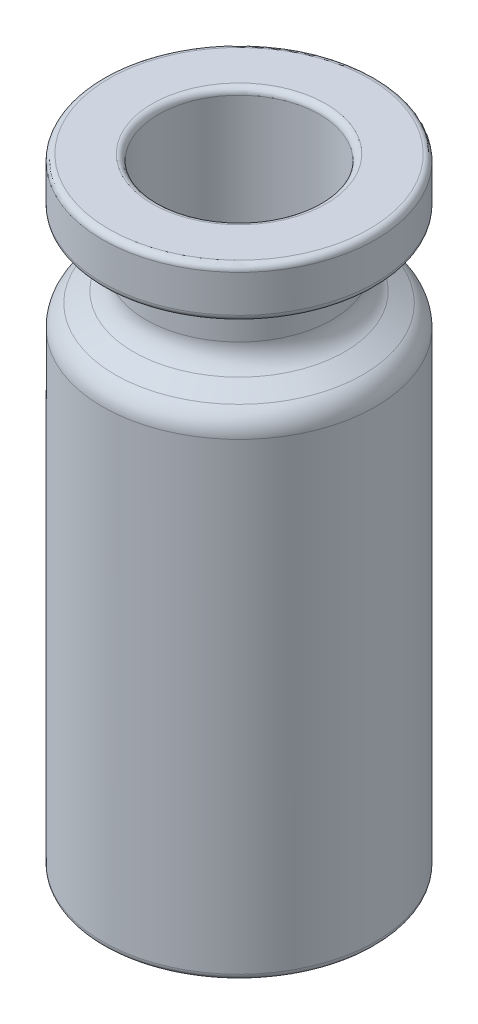
from build123d import *

# Parameters (mm, degrees)
FILLET1_R = 2
FILLET2_R = 0.5


with BuildPart() as part:
    # Sketch1 → Revolve1 (revolve)
    with BuildSketch(Plane.XY, mode=Mode.PRIVATE) as revolve1_sk:
        Polygon((0, 0), (11, 0), (11, 39), (7.5, 41), (7.5, 46), (11, 46), (11, 50), (6.5, 50), (6.5, 40.419677465), (10, 38.419677465), (10, 1), (0, 1), align=None)
    revolve(revolve1_sk.sketch.rotate(Axis((0, 0, 0), (0, 1, 0)), 90), axis=Axis((0, 0, 0), (0, 1, 0)))

    # Fillet1
    fillet1_edges = [part.edges().sort_by_distance(p)[0] for p in [
        (0, 46, 7.5),
        (0, 41, 7.5),
        (0, 39, 11),
    ]]
    fillet(fillet1_edges, radius=FILLET1_R)

    # Fillet2
    fillet2_edges = [part.edges().sort_by_distance(p)[0] for p in [
        (0, 50, 6.5),
        (0, 50, 11),
        (0, 46, 11),
        (0, 0, 11),
    ]]
    fillet(fillet2_edges, radius=FILLET2_R)


solid = part.part
